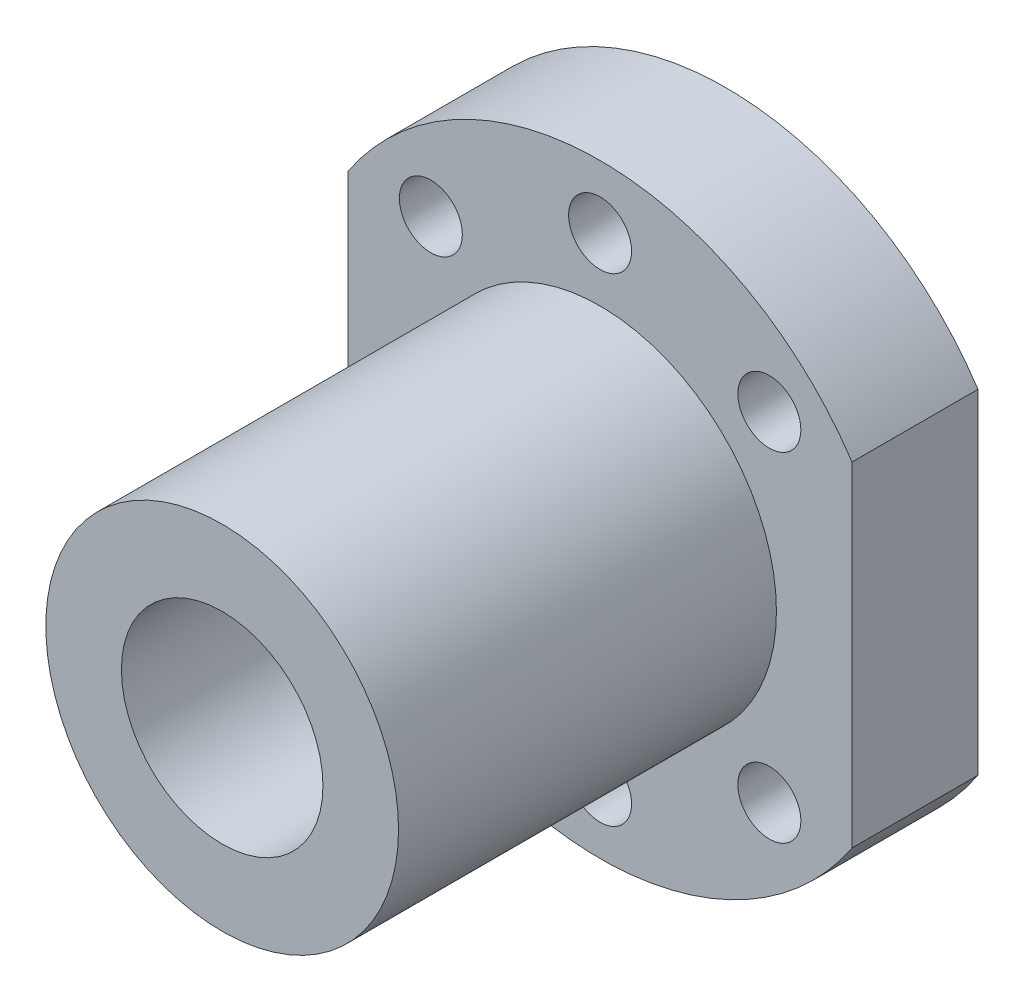
from build123d import *

# Parameters (mm, degrees)
SKETCH_1_R      = 2.5
SKETCH_1_R_2    = 8
EXTRUDE_1_DEPTH = 10
SKETCH_2_R      = 14
SKETCH_2_R_2    = 8
EXTRUDE_2_DEPTH = 30


with BuildPart() as part:
    # 草图1 → 凸台-拉伸1 (new body)
    with BuildSketch(Plane.XY):
        with BuildLine():
            Line((20, 13.266499161), (20, -13.266499161))
            ThreePointArc((20, -13.266499161), (0, -24), (-20, -13.266499161))
            Line((-20, -13.266499161), (-20, 13.266499161))
            ThreePointArc((-20, 13.266499161), (0, 24), (20, 13.266499161))
        make_face()
        with Locations((0, 19)):
            Circle(SKETCH_1_R, mode=Mode.SUBTRACT)
        with Locations((13.435028843, 13.435028843)):
            Circle(SKETCH_1_R, mode=Mode.SUBTRACT)
        with Locations((-13.435028843, 13.435028843)):
            Circle(SKETCH_1_R, mode=Mode.SUBTRACT)
        with Locations(Location((0, -19, 0), (0, 0, 180))):
            Circle(SKETCH_1_R, mode=Mode.SUBTRACT)
        with Locations(Location((-13.435028843, -13.435028843, 0), (0, 0, 180))):
            Circle(SKETCH_1_R, mode=Mode.SUBTRACT)
        with Locations(Location((13.435028843, -13.435028843, 0), (0, 0, 180))):
            Circle(SKETCH_1_R, mode=Mode.SUBTRACT)
        Circle(SKETCH_1_R_2, mode=Mode.SUBTRACT)
    extrude(amount=EXTRUDE_1_DEPTH)

    # 草图2 → 凸台-拉伸2 (add)
    with BuildSketch(Plane.XY.offset(10)):
        Circle(SKETCH_2_R)
        Circle(SKETCH_2_R_2, mode=Mode.SUBTRACT)
    extrude(amount=EXTRUDE_2_DEPTH)


solid = part.part
